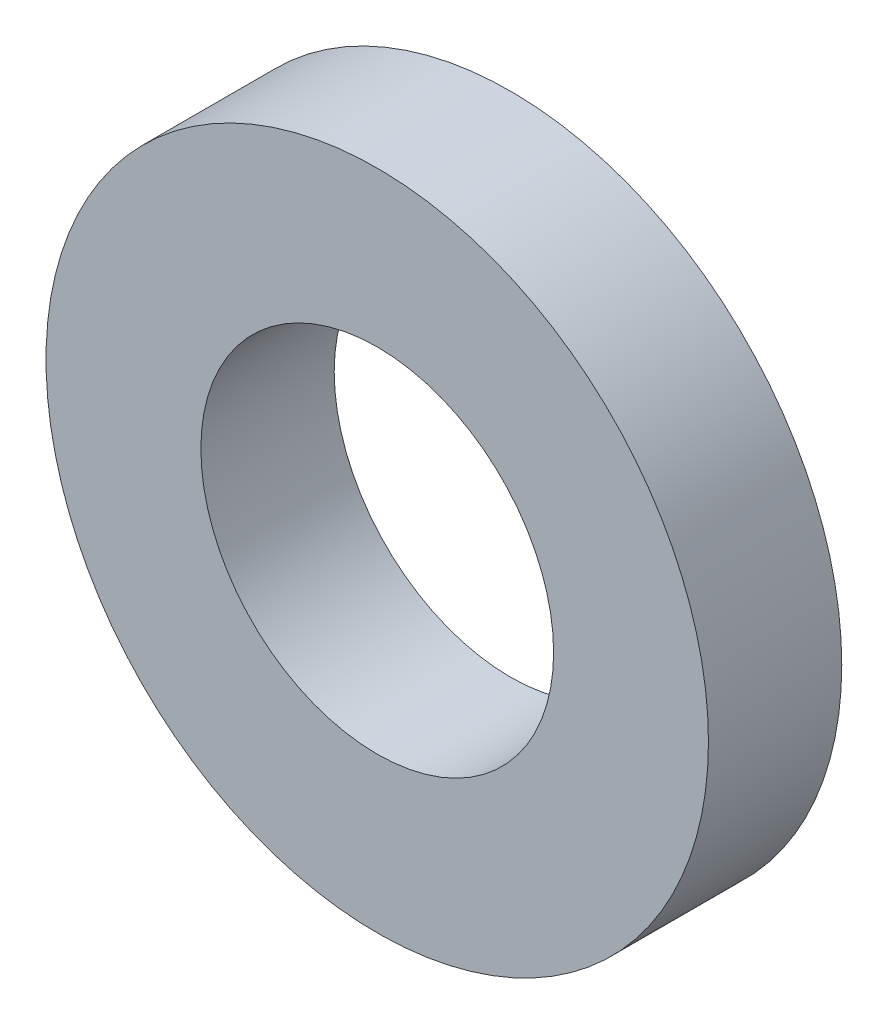
from build123d import *

# Parameters (mm, degrees)
SCHIZZO1_R                   = 11.925
ESTRUSIONE_ESTRUSIONE1_DEPTH = 4.8
FORO_25_5_12_7_1_D           = 12.7


with BuildPart() as part:
    # Schizzo1 → Estrusione-Estrusione1 (new body)
    with BuildSketch(Plane.XY):
        Circle(SCHIZZO1_R)
    extrude(amount=ESTRUSIONE_ESTRUSIONE1_DEPTH)

    # Foro Ø25.5 (12.7)-1 (through all)
    with Locations(Plane.XY.offset(4.8)):
        with Locations((0, 0)):
            Hole(FORO_25_5_12_7_1_D / 2)


solid = part.part
